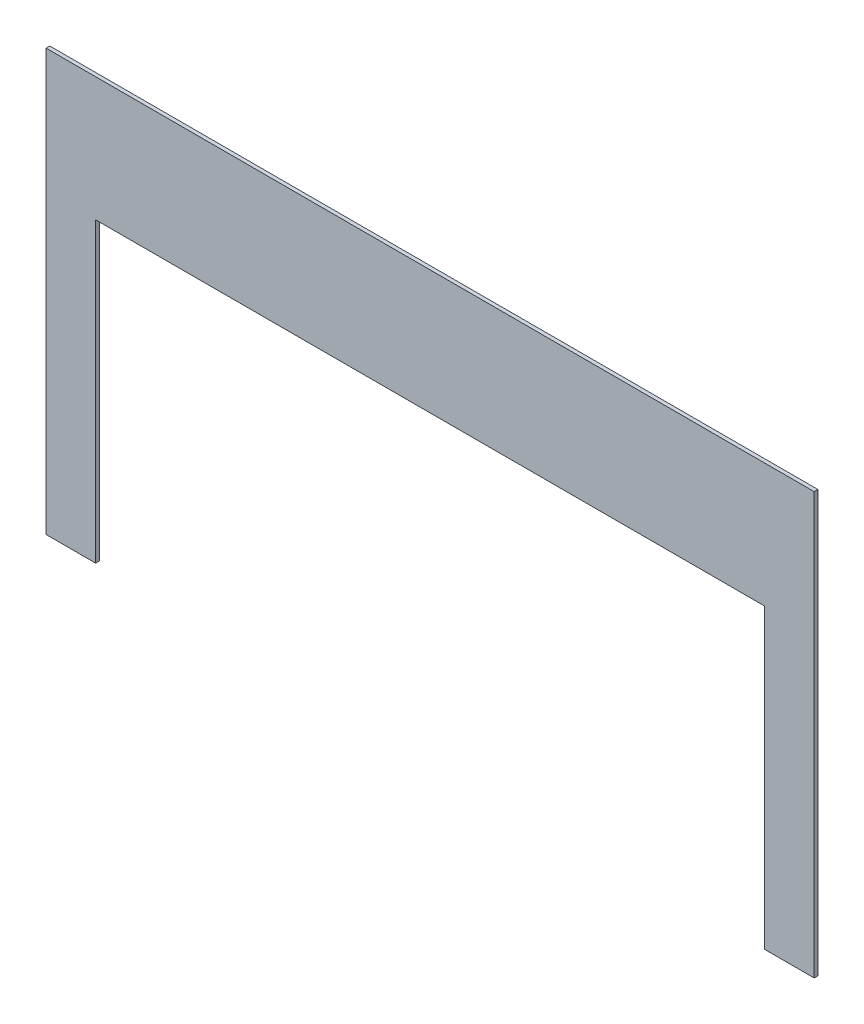
from build123d import *

# Parameters (mm, degrees)
PRESS_PANEL_UST_SOL_1_START = 38.5
SKETCH1_W                   = 310
SKETCH1_H                   = 170
PRESS_PANEL_UST_SOL_1_DEPTH = 1.5
PRESS_PANEL_UST_SOL_2_START = 37.5
SKETCH2_W                   = 270
SKETCH2_H                   = 140
PRESS_PANEL_UST_SOL_2_DEPTH = 3.5


with BuildPart() as part:
    # Sketch1 → PRESS_panel_ust_sol_1 (new body)
    with BuildSketch(Plane.XY.offset(PRESS_PANEL_UST_SOL_1_START)):
        with Locations((185, 1865)):
            Rectangle(SKETCH1_W, SKETCH1_H)
    extrude(amount=PRESS_PANEL_UST_SOL_1_DEPTH)

    # Sketch2 → PRESS_panel_ust_sol_2 (cut)
    with BuildSketch(Plane.XY.offset(PRESS_PANEL_UST_SOL_2_START)):
        with Locations((185, 1830)):
            Rectangle(SKETCH2_W, SKETCH2_H)
    extrude(amount=PRESS_PANEL_UST_SOL_2_DEPTH, mode=Mode.SUBTRACT)


solid = part.part
